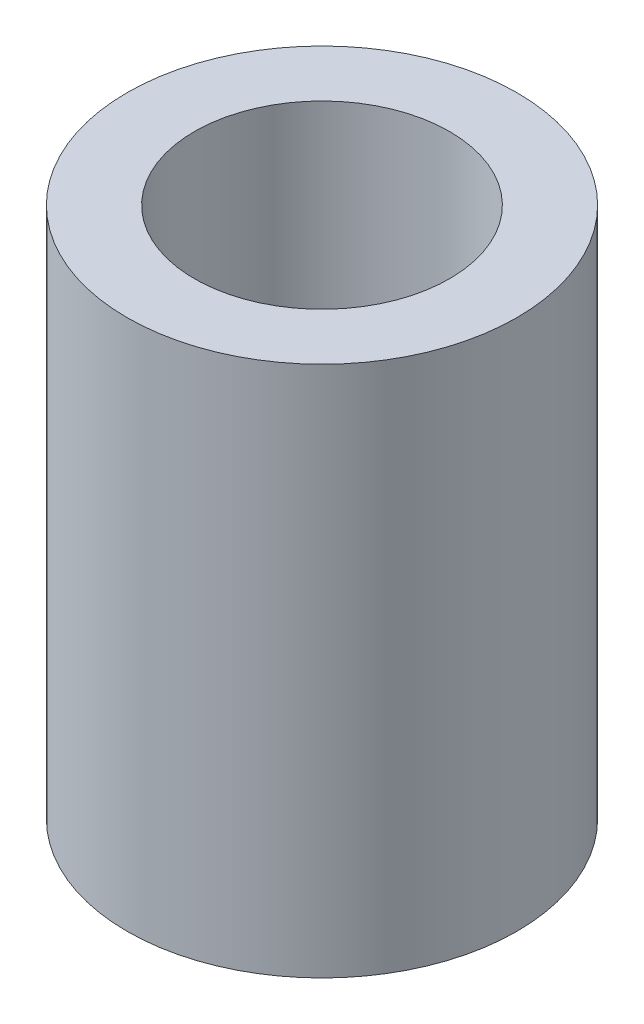
from build123d import *

# Parameters (mm, degrees)
SKETCH1_W = 7.6
SKETCH1_H = 60


with BuildPart() as part:
    # Sketch1 → Revolve1 (revolve)
    with BuildSketch(Plane.XY, mode=Mode.PRIVATE) as revolve1_sk:
        with Locations((18.2, 30)):
            Rectangle(SKETCH1_W, SKETCH1_H)
    revolve(revolve1_sk.sketch.rotate(Axis((0, 0, 0), (0, 1, 0)), 90), axis=Axis((0, 0, 0), (0, 1, 0)))


solid = part.part
